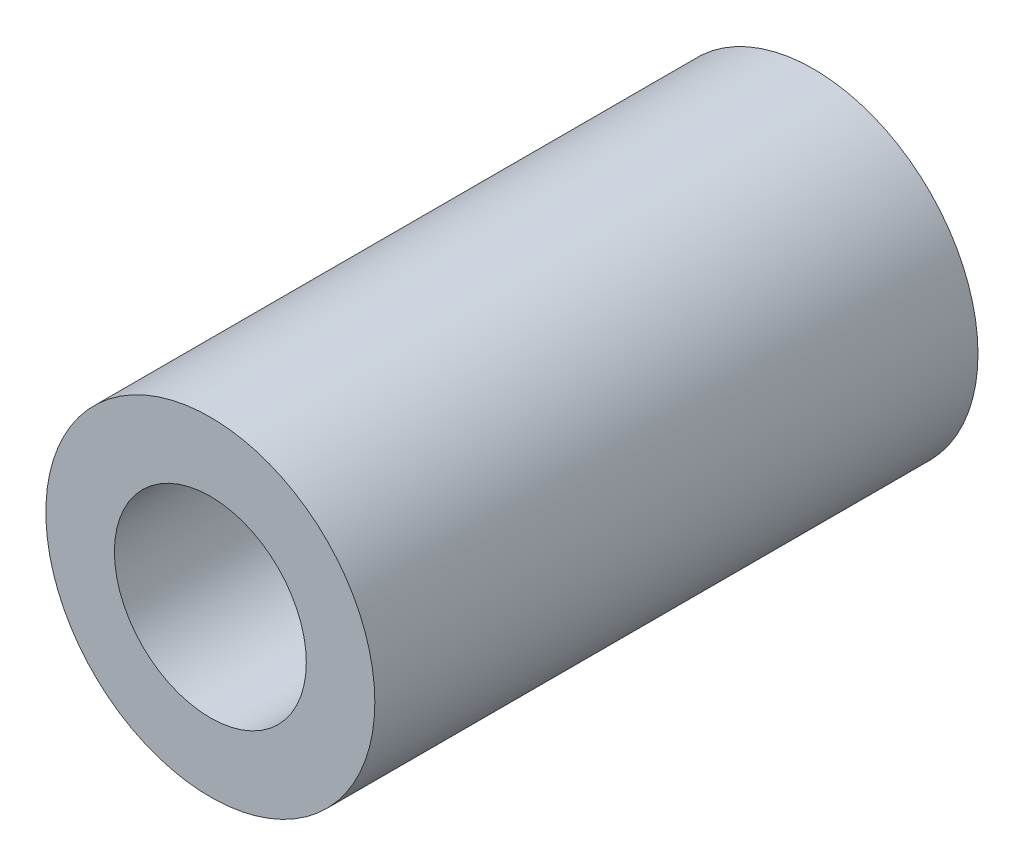
from build123d import *

# Parameters (mm, degrees)
SKETCH_3_R          = 3
SKETCH_3_R_2        = 1.75
EXTRUDE_28886_DEPTH = 11


with BuildPart() as part:
    # Sketch 3 → Extrude 28886 (new body)
    with BuildSketch(Plane.XY):
        Circle(SKETCH_3_R)
        Circle(SKETCH_3_R_2, mode=Mode.SUBTRACT)
    extrude(amount=EXTRUDE_28886_DEPTH)


solid = part.part
